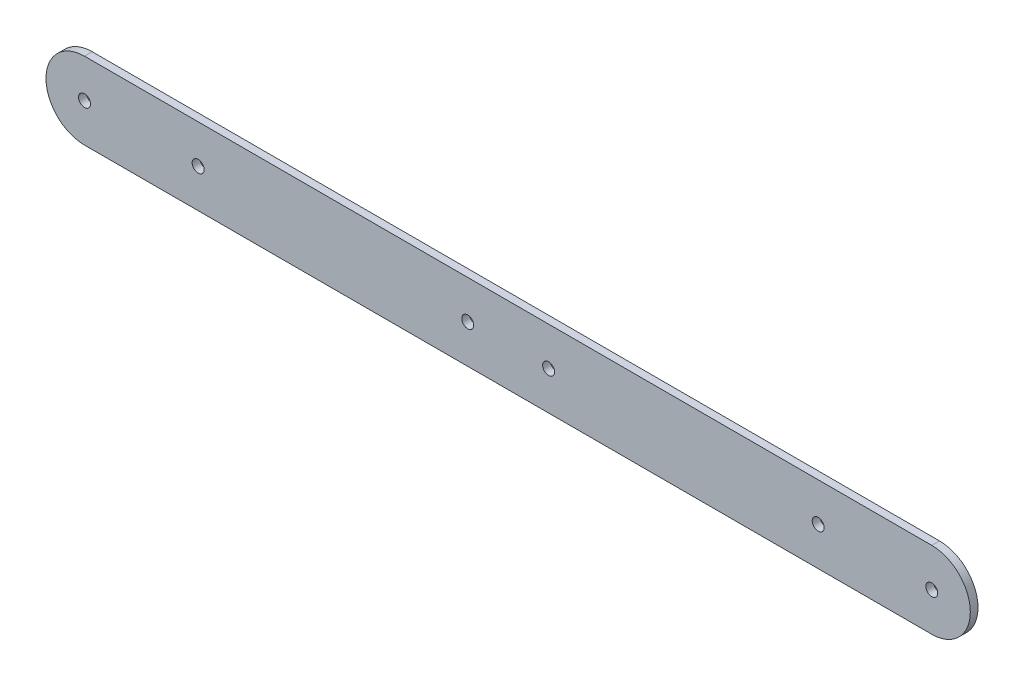
from build123d import *

# Parameters (mm, degrees)
SKETCH_1_R      = 1.55
EXTRUDE_1_DEPTH = 2


with BuildPart() as part:
    # 草图1 → 凸台-拉伸1 (new body)
    with BuildSketch(Plane.XY):
        with BuildLine():
            Line((-110, 10), (110, 10))
            ThreePointArc((110, 10), (120, 0), (110, -10))
            Line((110, -10), (-110, -10))
            ThreePointArc((-110, -10), (-120, 0), (-110, 10))
        make_face()
        with Locations((10.5, 0)):
            Circle(SKETCH_1_R, mode=Mode.SUBTRACT)
        with Locations((80.5, 0)):
            Circle(SKETCH_1_R, mode=Mode.SUBTRACT)
        with Locations(Location((-80.5, 0, 0), (0, 0, 180))):
            Circle(SKETCH_1_R, mode=Mode.SUBTRACT)
        with Locations(Location((-10.5, 0, 0), (0, 0, 180))):
            Circle(SKETCH_1_R, mode=Mode.SUBTRACT)
        with Locations((-110, 0)):
            Circle(SKETCH_1_R, mode=Mode.SUBTRACT)
        with Locations(Location((110, 0, 0), (0, 0, 180))):
            Circle(SKETCH_1_R, mode=Mode.SUBTRACT)
    extrude(amount=EXTRUDE_1_DEPTH)


solid = part.part
